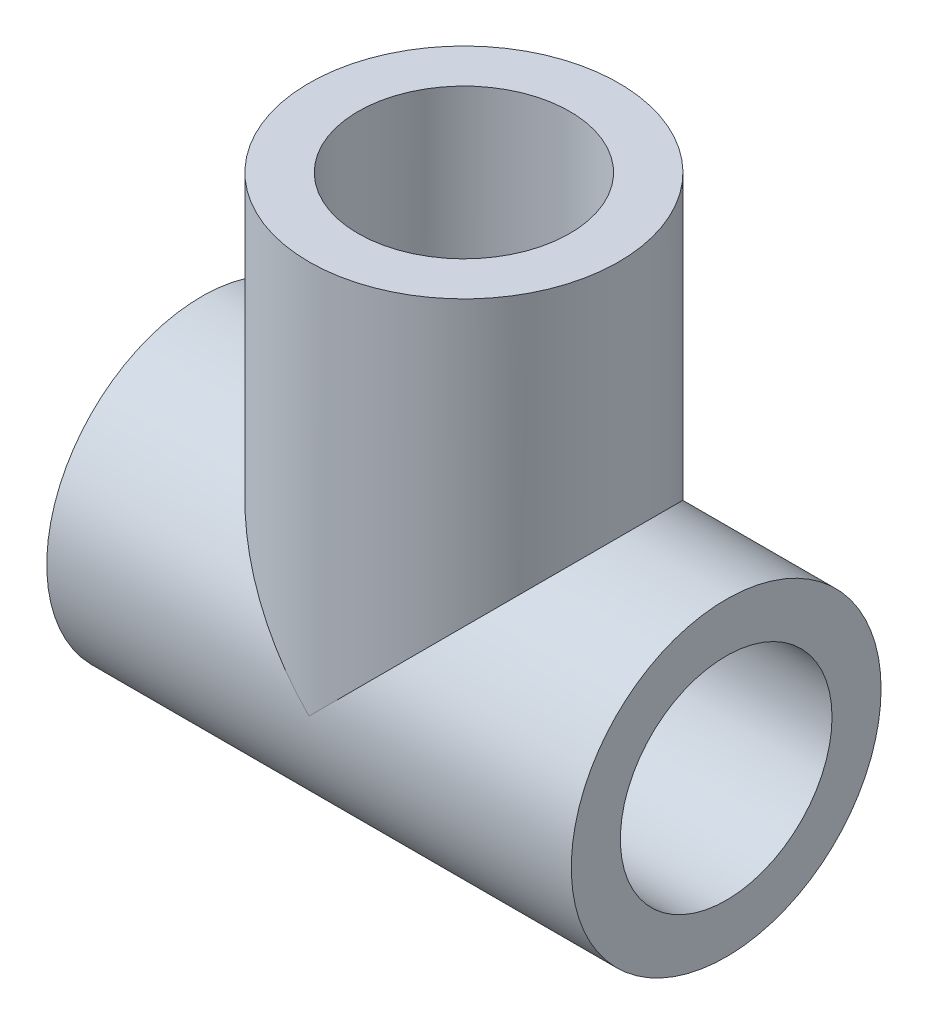
from build123d import *

# Parameters (mm, degrees)
SKETCH1_R               = 7.5
BOSS_EXTRUDE1_DEPTH     = 25.4
SKETCH2_R               = 7.5
BOSS_EXTRUDE2_DEPTH     = 19.05
SKETCH3_R               = 5.125
CUT_EXTRUDE1_DEPTH      = 33.62380266
CUT_EXTRUDE2_REACH      = 39.501
CUT_EXTRUDE2_END_RADIUS = 5.125
SKETCH4_R               = 5.125


with BuildPart() as part:
    # Sketch1 → Boss-Extrude1 (new body)
    with BuildSketch(Plane(origin=(0, 0, 0), x_dir=(0, 0, -1), z_dir=(1, 0, 0))):
        Circle(SKETCH1_R)
    extrude(amount=BOSS_EXTRUDE1_DEPTH)

    # Sketch2 → Boss-Extrude2 (add)
    with BuildSketch(Plane(origin=(0, 0, 0), x_dir=(1, 0, 0), z_dir=(0, 1, 0))):
        with Locations(Location((12.7, 0, 0), (0, 0, 270))):
            Circle(SKETCH2_R)
    extrude(amount=BOSS_EXTRUDE2_DEPTH)

    # Sketch3 → Cut-Extrude1 (cut, through all)
    with BuildSketch(Plane(origin=(25.4, 0, 0), x_dir=(0, 0, -1), z_dir=(1, 0, 0))):
        Circle(SKETCH3_R)
    extrude(amount=-CUT_EXTRUDE1_DEPTH, mode=Mode.SUBTRACT)

    # Cut-Extrude2: up to this cylinder (the profile starts outside it)
    cut_extrude2_end = Plane(origin=(12.7, 0, 0), z_dir=(1, 0, 0)) * Cylinder(CUT_EXTRUDE2_END_RADIUS, 90.252, mode=Mode.PRIVATE)
    # Sketch4 → Cut-Extrude2 (cut, up to the surface)
    with BuildSketch(Plane(origin=(0, 19.05, 0), x_dir=(1, 0, 0), z_dir=(0, 1, 0)), mode=Mode.PRIVATE) as cut_extrude2_sk1:
        with Locations(Location((12.7, 0, 0), (0, 0, 270))):
            Circle(SKETCH4_R)
    cut_extrude2_tool1 = extrude(cut_extrude2_sk1.sketch, amount=-CUT_EXTRUDE2_REACH, mode=Mode.PRIVATE) - cut_extrude2_end
    add(cut_extrude2_tool1.solids().sort_by_distance((12.7, 19.05, 0))[0], mode=Mode.SUBTRACT)


solid = part.part
